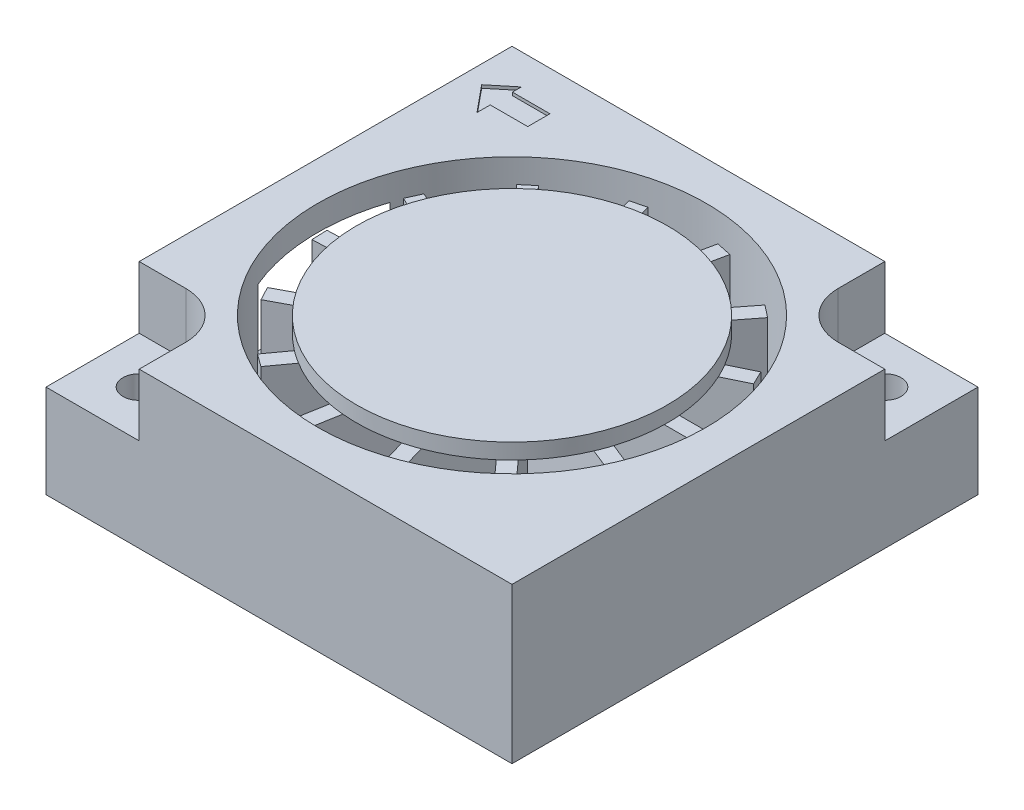
from build123d import *

# Parameters (mm, degrees)
SKETCH_1_W               = 30
SKETCH_1_H               = 30
EXTRUDE_1_DEPTH          = 10
SKETCH_2_W               = 6
SKETCH_2_H               = 6
CUT_EXTRUDE_1_DEPTH      = 4
SKETCH_3_R               = 12.5
CUT_EXTRUDE_2_DEPTH      = 8
FILLET_1_R               = 3
FILLET_2_R               = 3
CUT_EXTRUDE_3_DEPTH      = 0.2
SKETCH_5_R               = 1.05
CUT_EXTRUDE_4_DEPTH      = 10
SKETCH_6_W               = 11.699783002
SKETCH_6_H               = 1
EXTRUDE_2_DEPTH          = 7
PATTERN_CIRCULAR_1_COUNT = 14
PATTERN_CIRCULAR_1_ANGLE = 338
CUT_EXTRUDE_6_REACH      = 45.589
SKETCH_8_W               = 21.07962881
SKETCH_8_H               = 7.180633791
SKETCH_7_R               = 10
EXTRUDE_3_DEPTH          = 1


with BuildPart() as part:
    # 草图1 → 凸台-拉伸1 (new body)
    with BuildSketch(Plane(origin=(0, 0, 0), x_dir=(1, 0, 0), z_dir=(0, 1, 0))):
        with Locations((15, -15)):
            Rectangle(SKETCH_1_W, SKETCH_1_H)
    extrude(amount=EXTRUDE_1_DEPTH)

    # 草图2 → 切除-拉伸1 (cut)
    with BuildSketch(Plane(origin=(0, 10, 0), x_dir=(1, 0, 0), z_dir=(0, 1, 0))):
        with Locations((3, -27)):
            Rectangle(SKETCH_2_W, SKETCH_2_H)
        with Locations((27, -3)):
            Rectangle(SKETCH_2_W, SKETCH_2_H)
    extrude(amount=-CUT_EXTRUDE_1_DEPTH, mode=Mode.SUBTRACT)

    # 草图3 → 切除-拉伸2 (cut)
    with BuildSketch(Plane(origin=(0, 10, 0), x_dir=(1, 0, 0), z_dir=(0, 1, 0))):
        with Locations(Location((15, -15, 0), (0, 0, 270))):
            Circle(SKETCH_3_R)
    extrude(amount=-CUT_EXTRUDE_2_DEPTH, mode=Mode.SUBTRACT)

    # 圆角1
    fillet_1_edges = [part.edges().sort_by_distance(p)[0] for p in [
        (6, 8, 24),
    ]]
    fillet(fillet_1_edges, radius=FILLET_1_R)

    # 圆角2
    fillet_2_edges = [part.edges().sort_by_distance(p)[0] for p in [
        (24, 8, 6),
    ]]
    fillet(fillet_2_edges, radius=FILLET_2_R)

    # 草图4 → 切除-拉伸3 (cut)
    with BuildSketch(Plane(origin=(0, 10, 0), x_dir=(1, 0, 0), z_dir=(0, 1, 0))):
        Polygon((2.568201557, -1.964971172), (1.165606626, -3.118215893), (2.568201557, -4.824074593), (2.568201557, -3.971145243), (4.983781716, -3.971145243), (4.983781716, -2.541593533), (2.568201557, -2.541593533), align=None)
    extrude(amount=-CUT_EXTRUDE_3_DEPTH, mode=Mode.SUBTRACT)

    # 草图5 → 切除-拉伸4 (cut)
    with BuildSketch(Plane(origin=(0, 6, 0), x_dir=(1, 0, 0), z_dir=(0, 1, 0))):
        with Locations(Location((3, -27, 0), (0, 0, 270))):
            Circle(SKETCH_5_R)
        with Locations(Location((27, -3, 0), (0, 0, 270))):
            Circle(SKETCH_5_R)
    extrude(amount=-CUT_EXTRUDE_4_DEPTH, mode=Mode.SUBTRACT)

    # 草图6 → 凸台-拉伸2 (add)
    with BuildSketch(Plane(origin=(0, 2, 0), x_dir=(1, 0, 0), z_dir=(0, 1, 0))):
        with Locations((20.849891501, -14.693219625)):
            Rectangle(SKETCH_6_W, SKETCH_6_H)
    extrude_2 = extrude(amount=EXTRUDE_2_DEPTH)

    # 阵列(圆周)1: 凸台-拉伸2 ×14 about axis
    pattern_circular_1_axis = Axis((15, 0, 15), (0, 1, 0))
    for i in range(1, PATTERN_CIRCULAR_1_COUNT):
        add(extrude_2.rotate(pattern_circular_1_axis, i * PATTERN_CIRCULAR_1_ANGLE / (PATTERN_CIRCULAR_1_COUNT - 1)))

    # 切除-拉伸6: up to this plane
    cut_extrude_6_end = Plane(origin=(3.335500419, 9, 16.214605444), z_dir=(0.9993908270190957, 0, -0.034899496702506666))
    # 草图8 → 切除-拉伸6 (cut, up to the surface)
    with BuildSketch(Plane.ZY, mode=Mode.PRIVATE) as cut_extrude_6_sk1:
        with Locations((11.979819264, 4.784272805)):
            Rectangle(SKETCH_8_W, SKETCH_8_H)
    cut_extrude_6_tool1 = split(extrude(cut_extrude_6_sk1.sketch, amount=-CUT_EXTRUDE_6_REACH, mode=Mode.PRIVATE), bisect_by=cut_extrude_6_end, keep=Keep.BOTH, mode=Mode.PRIVATE)
    add(cut_extrude_6_tool1.solids().sort_by_distance((0, 4.784273, 11.979819))[0], mode=Mode.SUBTRACT)

    # 草图7 → 凸台-拉伸3 (add)
    with BuildSketch(Plane(origin=(0, 9, 0), x_dir=(1, 0, 0), z_dir=(0, 1, 0))):
        with Locations(Location((15, -15, 0), (0, 0, 82.627540404))):
            Circle(SKETCH_7_R)
    extrude(amount=EXTRUDE_3_DEPTH)


solid = part.part
